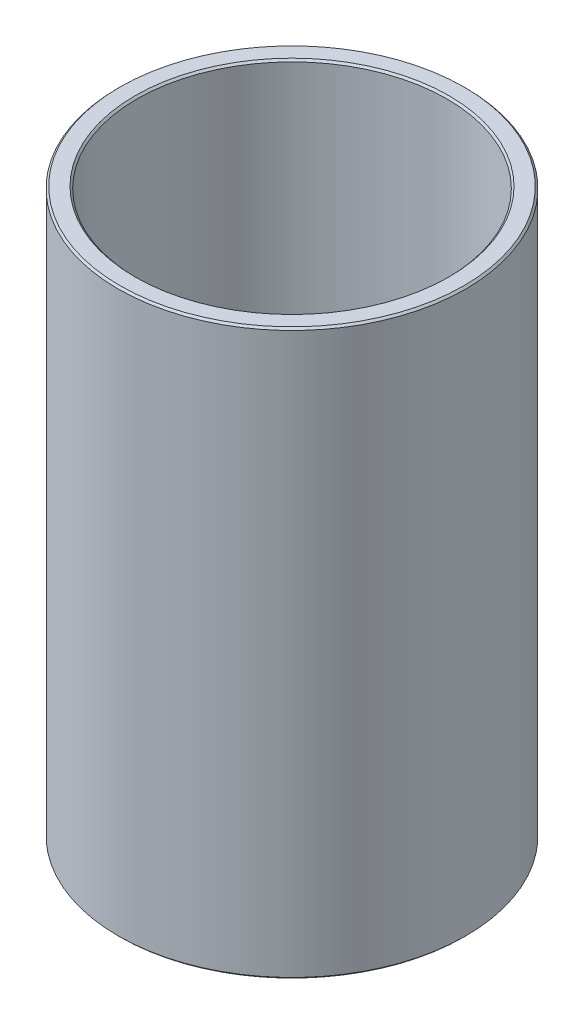
from build123d import *

# Parameters (mm, degrees)
CHAMFER1_SIZE = 0.2


with BuildPart() as part:
    # Sketch1 → Revolve1 (revolve)
    with BuildSketch(Plane.XY, mode=Mode.PRIVATE) as revolve1_sk:
        Polygon((16.5, 0), (18.5, 0), (18.5, 4), (18.5, 56), (18.5, 60), (16.5, 60), (16.5, 56), (16.5, 4), align=None)
    revolve(revolve1_sk.sketch.rotate(Axis((0, 0, 0), (0, 1, 0)), 90), axis=Axis((0, 0, 0), (0, 1, 0)))

    # Chamfer1
    chamfer1_edges = [part.edges().sort_by_distance(p)[0] for p in [
        (0, 0, 16.5),
        (0, 60, 16.5),
        (0, 60, 18.5),
        (0, 0, 18.5),
    ]]
    chamfer(chamfer1_edges, length=CHAMFER1_SIZE)


solid = part.part
